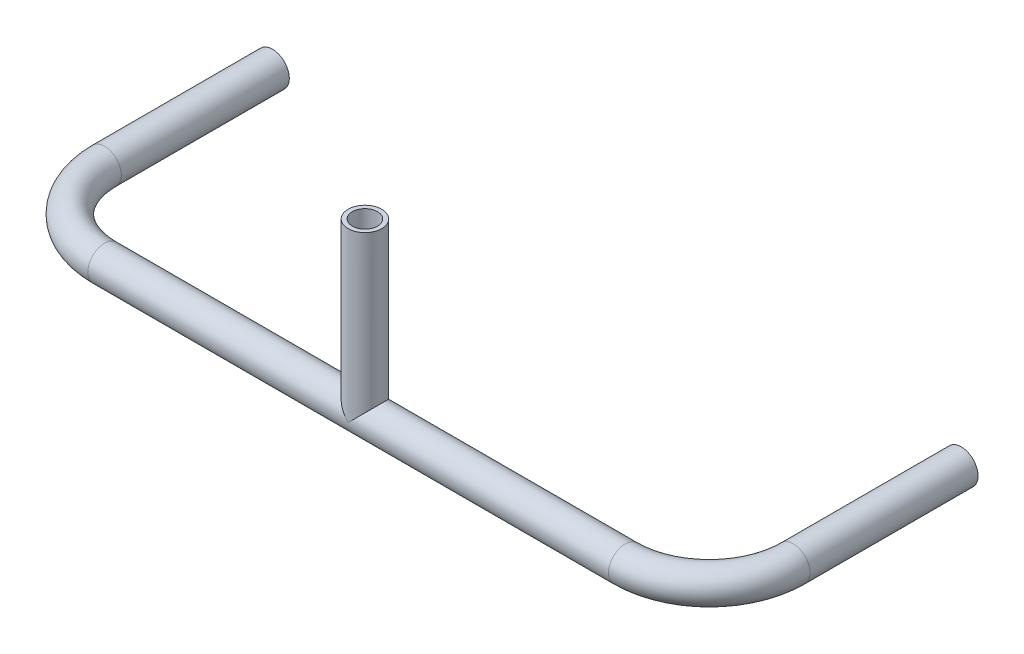
from build123d import *

# Parameters (mm, degrees)
SKETCH3_R           = 2
SKETCH3_R_2         = 1.5
SKETCH4_R           = 2
SKETCH4_R_2         = 1.5
BOSS_EXTRUDE1_DEPTH = 20


with BuildPart() as part:
    # Sweep1: sweep along a path in Sketch2
    with BuildLine(Plane(origin=(0, 0, 0), x_dir=(1, 0, 0), z_dir=(0, 1, 0))) as sweep1_path:
        Line((-41, 0), (-41, -20))
        ThreePointArc((-41, -20), (-38.071067812, -27.071067812), (-31, -30))
        Line((-31, -30), (31, -30))
        ThreePointArc((31, -30), (38.071067812, -27.071067812), (41, -20))
        Line((41, -20), (41, 0))
    # Sketch3 → Sweep1 (sweep)
    with BuildSketch(Plane.XY):
        with Locations((-41, 0)):
            Circle(SKETCH3_R)
        with Locations((-41, 0)):
            Circle(SKETCH3_R_2, mode=Mode.SUBTRACT)
    sweep(path=sweep1_path.line)

    # Sketch4 → Boss-Extrude1 (add)
    with BuildSketch(Plane(origin=(0, 0, 0), x_dir=(1, 0, 0), z_dir=(0, 1, 0))):
        with Locations(Location((0, -30, 0), (0, 0, 270))):
            Circle(SKETCH4_R)
        with Locations(Location((0, -30, 0), (0, 0, 90))):
            Circle(SKETCH4_R_2, mode=Mode.SUBTRACT)
    extrude(amount=BOSS_EXTRUDE1_DEPTH)


solid = part.part
